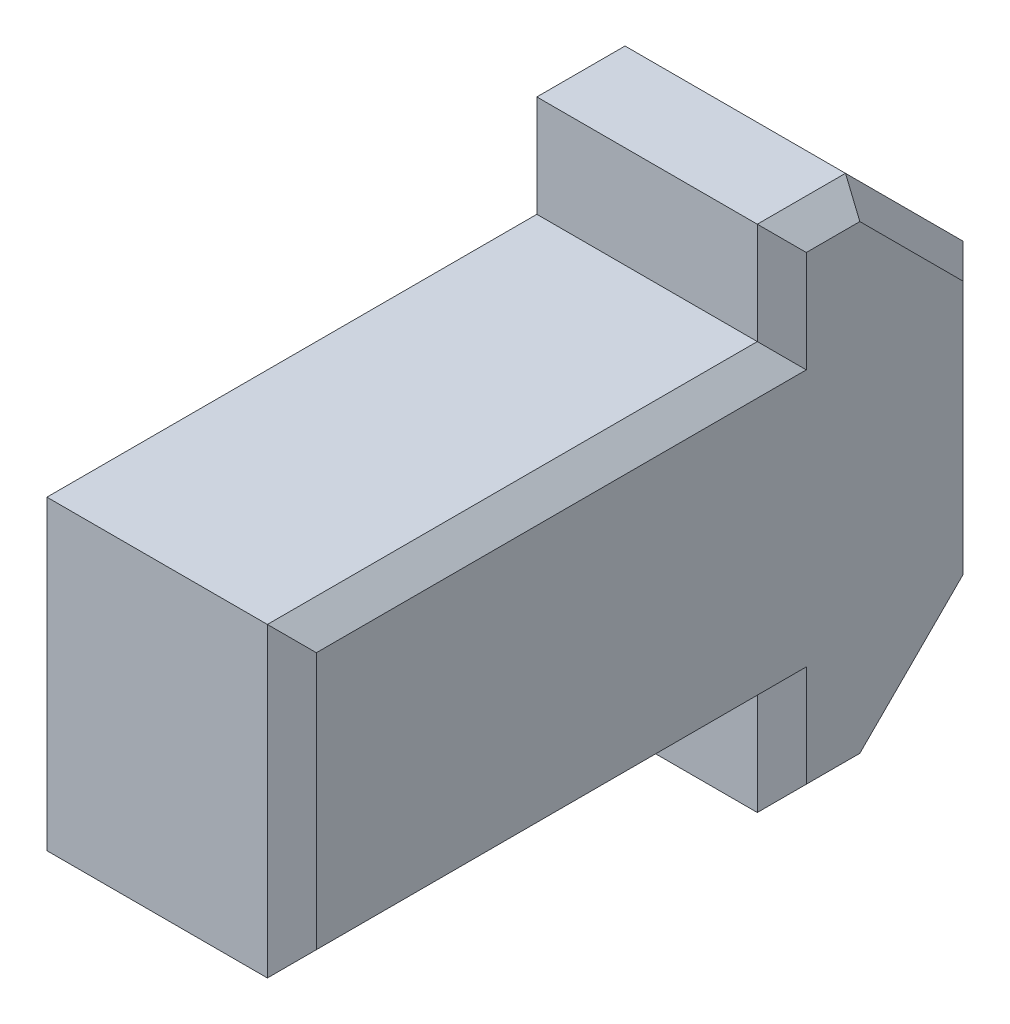
from build123d import *

# Parameters (mm, degrees)
BOSS_EXTRUDE1_DEPTH = 5
CHAMFER1_SIZE       = 0.5


with BuildPart() as part:
    # Sketch2 → Boss-Extrude1 (new body)
    with BuildSketch(Plane(origin=(0, 0, 0), x_dir=(0, 0, -1), z_dir=(1, 0, 0))):
        Polygon((-4.2, 3.125), (-14.2, 3.125), (-14.2, -3.125), (-4.2, -3.125), (-4.2, -5.2), (-2.4, -5.2), (0, -2.8), (0, 2.8), (-2.4, 5.2), (-4.2, 5.2), align=None)
    extrude(amount=BOSS_EXTRUDE1_DEPTH)

    # Chamfer1
    chamfer1_edges = [part.edges().sort_by_distance(p)[0] for p in [
        (5, 0, 14.2),
        (5, -3.125, 9.2),
        (5, -4.1625, 4.2),
        (5, -5.2, 3.3),
        (5, -4, 1.2),
        (5, 0, 0),
        (5, 4, 1.2),
        (5, 5.2, 3.3),
        (5, 4.1625, 4.2),
        (5, 3.125, 9.2),
    ]]
    chamfer(chamfer1_edges, length=CHAMFER1_SIZE)


solid = part.part
